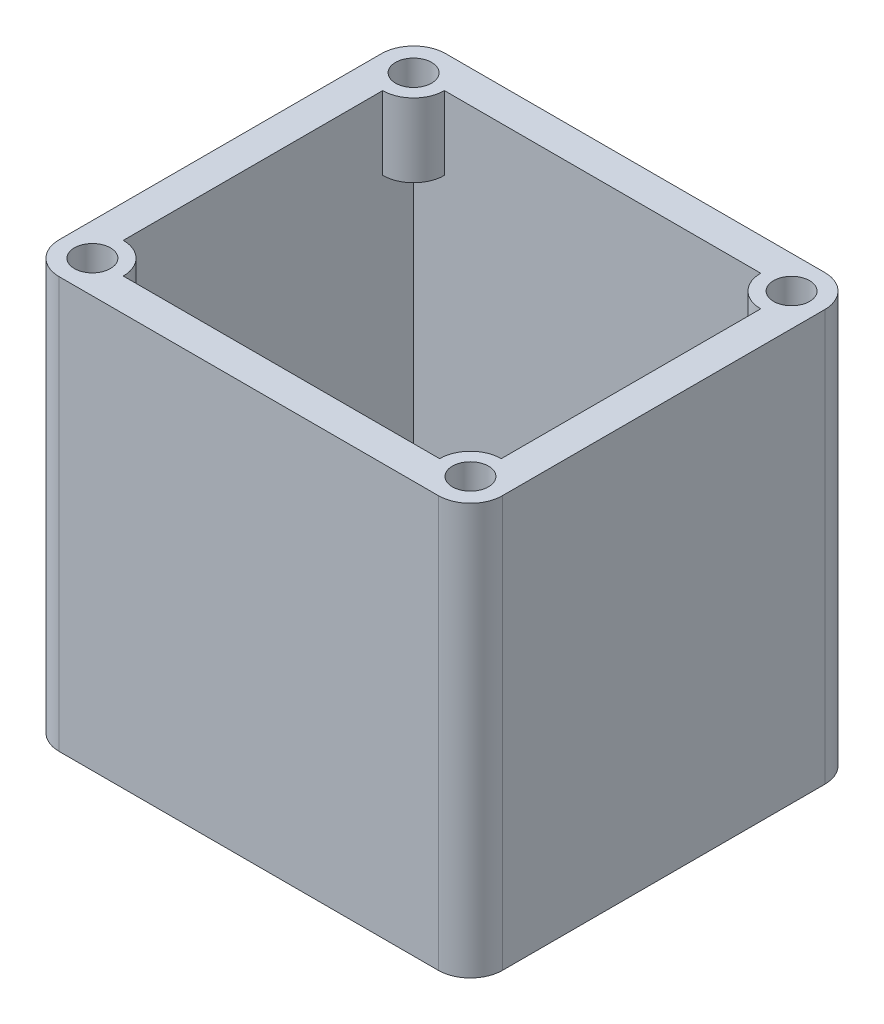
from build123d import *

# Parameters (mm, degrees)
SKETCH1_W           = 69.01
SKETCH1_H           = 60.16
BOSS_EXTRUDE3_DEPTH = 64.008
SKETCH2_W           = 58.85
SKETCH2_H           = 50
CUT_EXTRUDE4_DEPTH  = 58.928
FILLET1_R           = 5
SKETCH3_R           = 4.8067
BOSS_EXTRUDE4_DEPTH = 11.43
SKETCH3_3_R         = 2.8067
CUT_EXTRUDE5_DEPTH  = 6.35
SKETCH9_R           = 4.8067
SKETCH9_R_2         = 2.8067
BOSS_EXTRUDE5_DEPTH = 6.35
SKETCH10_R          = 2.159
CUT_EXTRUDE6_DEPTH  = 5.08
BOSS_EXTRUDE6_DEPTH = 1


with BuildPart() as part:
    # Sketch1 → Boss-Extrude3 (new body)
    with BuildSketch(Plane(origin=(0, 0, 0), x_dir=(1, 0, 0), z_dir=(0, 1, 0))):
        Rectangle(SKETCH1_W, SKETCH1_H)
    extrude(amount=BOSS_EXTRUDE3_DEPTH)

    # Sketch2 → Cut-Extrude4 (cut)
    with BuildSketch(Plane(origin=(0, 64.008, 0), x_dir=(1, 0, 0), z_dir=(0, 1, 0))):
        Rectangle(SKETCH2_W, SKETCH2_H)
    extrude(amount=-CUT_EXTRUDE4_DEPTH, mode=Mode.SUBTRACT)

    # Fillet1
    fillet1_edges = [part.edges().sort_by_distance(p)[0] for p in [
        (-34.505, 32.004, 30.08),
        (34.505, 32.004, 30.08),
        (34.505, 32.004, -30.08),
        (-34.505, 32.004, -30.08),
    ]]
    fillet(fillet1_edges, radius=FILLET1_R)

    # Sketch3 → Boss-Extrude4 (add)
    with BuildSketch(Plane(origin=(0, 64.008, 0), x_dir=(1, 0, 0), z_dir=(0, 1, 0))):
        with Locations((-29.425, 25)):
            Circle(SKETCH3_R)
        with Locations((29.425, 25)):
            Circle(SKETCH3_R)
        with Locations((-29.425, -25)):
            Circle(SKETCH3_R)
        with Locations((29.425, -25)):
            Circle(SKETCH3_R)
    extrude(amount=-BOSS_EXTRUDE4_DEPTH)

    # Sketch3<3> → Cut-Extrude5 (cut)
    with BuildSketch(Plane(origin=(0, 64.008, 0), x_dir=(1, 0, 0), z_dir=(0, 1, 0))):
        with Locations(Location((-29.425, 25, 0), (0, 0, 270))):
            Circle(SKETCH3_3_R)
        with Locations(Location((29.425, 25, 0), (0, 0, 270))):
            Circle(SKETCH3_3_R)
        with Locations(Location((29.425, -25, 0), (0, 0, 270))):
            Circle(SKETCH3_3_R)
        with Locations(Location((-29.425, -25, 0), (0, 0, 270))):
            Circle(SKETCH3_3_R)
    extrude(amount=-CUT_EXTRUDE5_DEPTH, mode=Mode.SUBTRACT)

    # Sketch9 → Boss-Extrude5 (add)
    # profile 1 of 4: a face of its own
    with BuildSketch(Plane(origin=(0, 5.08, 0), x_dir=(1, 0, 0), z_dir=(0, 1, 0))):
        with Locations(Location((-23.225, 18.85, 0), (0, 0, 90))):
            Circle(SKETCH9_R)
        with Locations(Location((-23.225, 18.85, 0), (0, 0, 270))):
            Circle(SKETCH9_R_2, mode=Mode.SUBTRACT)
    # profile 2 of 4: a face of its own
    with BuildSketch(Plane(origin=(0, 5.08, 0), x_dir=(1, 0, 0), z_dir=(0, 1, 0))):
        with Locations(Location((23.525, 19.1, 0), (0, 0, 90))):
            Circle(SKETCH9_R)
        with Locations(Location((23.525, 19.1, 0), (0, 0, 270))):
            Circle(SKETCH9_R_2, mode=Mode.SUBTRACT)
    # profile 3 of 4: a face of its own
    with BuildSketch(Plane(origin=(0, 5.08, 0), x_dir=(1, 0, 0), z_dir=(0, 1, 0))):
        with Locations(Location((23.275, -19.05, 0), (0, 0, 90))):
            Circle(SKETCH9_R)
        with Locations(Location((23.275, -19.05, 0), (0, 0, 270))):
            Circle(SKETCH9_R_2, mode=Mode.SUBTRACT)
    # profile 4 of 4: a face of its own
    with BuildSketch(Plane(origin=(0, 5.08, 0), x_dir=(1, 0, 0), z_dir=(0, 1, 0))):
        with Locations(Location((-23.475, -19.05, 0), (0, 0, 90))):
            Circle(SKETCH9_R)
        with Locations(Location((-23.475, -19.05, 0), (0, 0, 270))):
            Circle(SKETCH9_R_2, mode=Mode.SUBTRACT)
    extrude(amount=BOSS_EXTRUDE5_DEPTH)

    # Sketch10 → Cut-Extrude6 (cut)
    with BuildSketch(Plane(origin=(0, 5.08, 0), x_dir=(1, 0, 0), z_dir=(0, 1, 0))):
        with Locations(Location((14.2125, 12, 0), (0, 0, 270))):
            Circle(SKETCH10_R)
        with Locations(Location((14.2125, -12, 0), (0, 0, 270))):
            Circle(SKETCH10_R)
        with Locations(Location((-14.2125, 12, 0), (0, 0, 270))):
            Circle(SKETCH10_R)
        with Locations(Location((-14.2125, -12, 0), (0, 0, 270))):
            Circle(SKETCH10_R)
    extrude(amount=-CUT_EXTRUDE6_DEPTH, mode=Mode.SUBTRACT)

    # Sketch12 → Boss-Extrude6 (add)
    with BuildSketch(Plane(origin=(0, 5.08, 0), x_dir=(1, 0, 0), z_dir=(0, 1, 0))):
        Polygon((-26.546494391, 13.274758956), (-25.899358974, 13.274758956), (-25.899358974, 9.774758956), (-26.213461538, 9.774758956), (-26.213461538, 12.915784597), (-26.751923077, 12.915784597), align=None)
    extrude(amount=BOSS_EXTRUDE6_DEPTH)


solid = part.part
